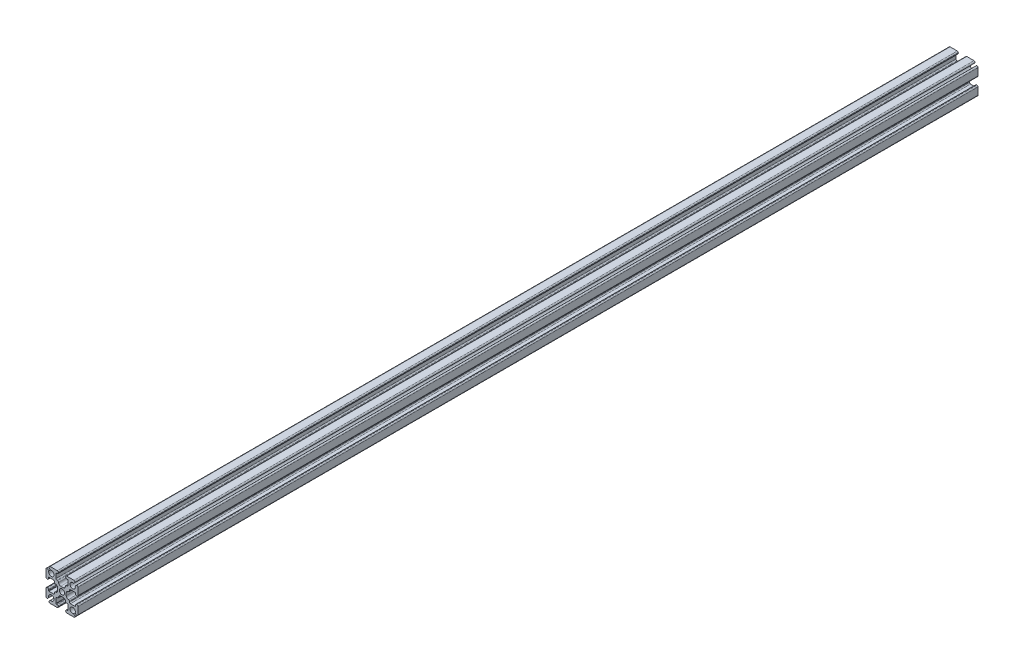
from build123d import *

# Parameters (mm, degrees)
SKETCH1_R           = 1.25
BOSS_EXTRUDE1_DEPTH = 422.400000004


with BuildPart() as part:
    # Sketch1 → Boss-Extrude1 (new body)
    with BuildSketch(Plane.XY):
        with BuildLine():
            Line((6.646446609, 5.939339828), (6.163645978, 5.456539197))
            ThreePointArc((6.163645978, 5.456539197), (4.116116524, 4.116116524), (5.456539197, 6.163645978))
            Line((5.456539197, 6.163645978), (5.939339828, 6.646446609))
            ThreePointArc((5.939339828, 6.646446609), (6.047726204, 7.191341716), (5.585786438, 7.5))
            Line((5.585786438, 7.5), (2.25, 7.5))
            ThreePointArc((2.25, 7.5), (1.896446609, 7.353553391), (1.75, 7))
            Line((1.75, 7), (1.75, 6.8))
            ThreePointArc((1.75, 6.8), (1.896446609, 6.446446609), (2.25, 6.3))
            Line((2.25, 6.3), (2.65, 6.3))
            ThreePointArc((2.65, 6.3), (2.791421356, 6.241421356), (2.85, 6.1))
            Line((2.85, 6.1), (2.85, 4))
            ThreePointArc((2.85, 4), (2.703553391, 3.646446609), (2.35, 3.5))
            Line((2.35, 3.5), (2.1, 3.5))
            ThreePointArc((2.1, 3.5), (1.746446609, 3.353553391), (1.6, 3))
            ThreePointArc((1.6, 3), (1.307106781, 2.292893219), (0.6, 2))
            Line((0.6, 2), (-0.6, 2))
            ThreePointArc((-0.6, 2), (-1.307106781, 2.292893219), (-1.6, 3))
            ThreePointArc((-1.6, 3), (-1.746446609, 3.353553391), (-2.1, 3.5))
            Line((-2.1, 3.5), (-2.35, 3.5))
            ThreePointArc((-2.35, 3.5), (-2.703553391, 3.646446609), (-2.85, 4))
            Line((-2.85, 4), (-2.85, 6.1))
            ThreePointArc((-2.85, 6.1), (-2.791421356, 6.241421356), (-2.65, 6.3))
            Line((-2.65, 6.3), (-2.25, 6.3))
            ThreePointArc((-2.25, 6.3), (-1.896446609, 6.446446609), (-1.75, 6.8))
            Line((-1.75, 6.8), (-1.75, 7))
            ThreePointArc((-1.75, 7), (-1.896446609, 7.353553391), (-2.25, 7.5))
            Line((-2.25, 7.5), (-5.585786438, 7.5))
            ThreePointArc((-5.585786438, 7.5), (-6.047726204, 7.191341716), (-5.939339828, 6.646446609))
            Line((-5.939339828, 6.646446609), (-5.456539197, 6.163645978))
            ThreePointArc((-5.456539197, 6.163645978), (-4.116116524, 4.116116524), (-6.163645978, 5.456539197))
            Line((-6.163645978, 5.456539197), (-6.646446609, 5.939339828))
            ThreePointArc((-6.646446609, 5.939339828), (-7.191341716, 6.047726204), (-7.5, 5.585786438))
            Line((-7.5, 5.585786438), (-7.5, 2.25))
            ThreePointArc((-7.5, 2.25), (-7.353553391, 1.896446609), (-7, 1.75))
            Line((-7, 1.75), (-6.8, 1.75))
            ThreePointArc((-6.8, 1.75), (-6.446446609, 1.896446609), (-6.3, 2.25))
            Line((-6.3, 2.25), (-6.3, 2.65))
            ThreePointArc((-6.3, 2.65), (-6.241421356, 2.791421356), (-6.1, 2.85))
            Line((-6.1, 2.85), (-4, 2.85))
            ThreePointArc((-4, 2.85), (-3.646446609, 2.703553391), (-3.5, 2.35))
            Line((-3.5, 2.35), (-3.5, 2.1))
            ThreePointArc((-3.5, 2.1), (-3.353553391, 1.746446609), (-3, 1.6))
            ThreePointArc((-3, 1.6), (-2.292893219, 1.307106781), (-2, 0.6))
            Line((-2, 0.6), (-2, -0.6))
            ThreePointArc((-2, -0.6), (-2.292893219, -1.307106781), (-3, -1.6))
            ThreePointArc((-3, -1.6), (-3.353553391, -1.746446609), (-3.5, -2.1))
            Line((-3.5, -2.1), (-3.5, -2.35))
            ThreePointArc((-3.5, -2.35), (-3.646446609, -2.703553391), (-4, -2.85))
            Line((-4, -2.85), (-6.1, -2.85))
            ThreePointArc((-6.1, -2.85), (-6.241421356, -2.791421356), (-6.3, -2.65))
            Line((-6.3, -2.65), (-6.3, -2.25))
            ThreePointArc((-6.3, -2.25), (-6.446446609, -1.896446609), (-6.8, -1.75))
            Line((-6.8, -1.75), (-7, -1.75))
            ThreePointArc((-7, -1.75), (-7.353553391, -1.896446609), (-7.5, -2.25))
            Line((-7.5, -2.25), (-7.5, -5.585786438))
            ThreePointArc((-7.5, -5.585786438), (-7.191341716, -6.047726204), (-6.646446609, -5.939339828))
            Line((-6.646446609, -5.939339828), (-6.163645978, -5.456539197))
            ThreePointArc((-6.163645978, -5.456539197), (-4.116116524, -4.116116524), (-5.456539197, -6.163645978))
            Line((-5.456539197, -6.163645978), (-5.939339828, -6.646446609))
            ThreePointArc((-5.939339828, -6.646446609), (-6.047726204, -7.191341716), (-5.585786438, -7.5))
            Line((-5.585786438, -7.5), (-2.25, -7.5))
            ThreePointArc((-2.25, -7.5), (-1.896446609, -7.353553391), (-1.75, -7))
            Line((-1.75, -7), (-1.75, -6.8))
            ThreePointArc((-1.75, -6.8), (-1.896446609, -6.446446609), (-2.25, -6.3))
            Line((-2.25, -6.3), (-2.65, -6.3))
            ThreePointArc((-2.65, -6.3), (-2.791421356, -6.241421356), (-2.85, -6.1))
            Line((-2.85, -6.1), (-2.85, -4))
            ThreePointArc((-2.85, -4), (-2.703553391, -3.646446609), (-2.35, -3.5))
            Line((-2.35, -3.5), (-2.1, -3.5))
            ThreePointArc((-2.1, -3.5), (-1.746446609, -3.353553391), (-1.6, -3))
            ThreePointArc((-1.6, -3), (-1.307106781, -2.292893219), (-0.6, -2))
            Line((-0.6, -2), (0.6, -2))
            ThreePointArc((0.6, -2), (1.307106781, -2.292893219), (1.6, -3))
            ThreePointArc((1.6, -3), (1.746446609, -3.353553391), (2.1, -3.5))
            Line((2.1, -3.5), (2.35, -3.5))
            ThreePointArc((2.35, -3.5), (2.703553391, -3.646446609), (2.85, -4))
            Line((2.85, -4), (2.85, -6.1))
            ThreePointArc((2.85, -6.1), (2.791421356, -6.241421356), (2.65, -6.3))
            Line((2.65, -6.3), (2.25, -6.3))
            ThreePointArc((2.25, -6.3), (1.896446609, -6.446446609), (1.75, -6.8))
            Line((1.75, -6.8), (1.75, -7))
            ThreePointArc((1.75, -7), (1.896446609, -7.353553391), (2.25, -7.5))
            Line((2.25, -7.5), (5.585786438, -7.5))
            ThreePointArc((5.585786438, -7.5), (6.047726204, -7.191341716), (5.939339828, -6.646446609))
            Line((5.939339828, -6.646446609), (5.456539197, -6.163645978))
            ThreePointArc((5.456539197, -6.163645978), (4.116116524, -4.116116524), (6.163645978, -5.456539197))
            Line((6.163645978, -5.456539197), (6.646446609, -5.939339828))
            ThreePointArc((6.646446609, -5.939339828), (7.191341716, -6.047726204), (7.5, -5.585786438))
            Line((7.5, -5.585786438), (7.5, -2.25))
            ThreePointArc((7.5, -2.25), (7.353553391, -1.896446609), (7, -1.75))
            Line((7, -1.75), (6.8, -1.75))
            ThreePointArc((6.8, -1.75), (6.446446609, -1.896446609), (6.3, -2.25))
            Line((6.3, -2.25), (6.3, -2.65))
            ThreePointArc((6.3, -2.65), (6.241421356, -2.791421356), (6.1, -2.85))
            Line((6.1, -2.85), (4, -2.85))
            ThreePointArc((4, -2.85), (3.646446609, -2.703553391), (3.5, -2.35))
            Line((3.5, -2.35), (3.5, -2.1))
            ThreePointArc((3.5, -2.1), (3.353553391, -1.746446609), (3, -1.6))
            ThreePointArc((3, -1.6), (2.292893219, -1.307106781), (2, -0.6))
            Line((2, -0.6), (2, 0.6))
            ThreePointArc((2, 0.6), (2.292893219, 1.307106781), (3, 1.6))
            ThreePointArc((3, 1.6), (3.353553391, 1.746446609), (3.5, 2.1))
            Line((3.5, 2.1), (3.5, 2.35))
            ThreePointArc((3.5, 2.35), (3.646446609, 2.703553391), (4, 2.85))
            Line((4, 2.85), (6.1, 2.85))
            ThreePointArc((6.1, 2.85), (6.241421356, 2.791421356), (6.3, 2.65))
            Line((6.3, 2.65), (6.3, 2.25))
            ThreePointArc((6.3, 2.25), (6.446446609, 1.896446609), (6.8, 1.75))
            Line((6.8, 1.75), (7, 1.75))
            ThreePointArc((7, 1.75), (7.353553391, 1.896446609), (7.5, 2.25))
            Line((7.5, 2.25), (7.5, 5.585786438))
            ThreePointArc((7.5, 5.585786438), (7.191341716, 6.047726204), (6.646446609, 5.939339828))
        make_face()
        with Locations(Location((0, 0, 0), (0, 0, 180))):
            Circle(SKETCH1_R, mode=Mode.SUBTRACT)
    extrude(amount=BOSS_EXTRUDE1_DEPTH)


solid = part.part
